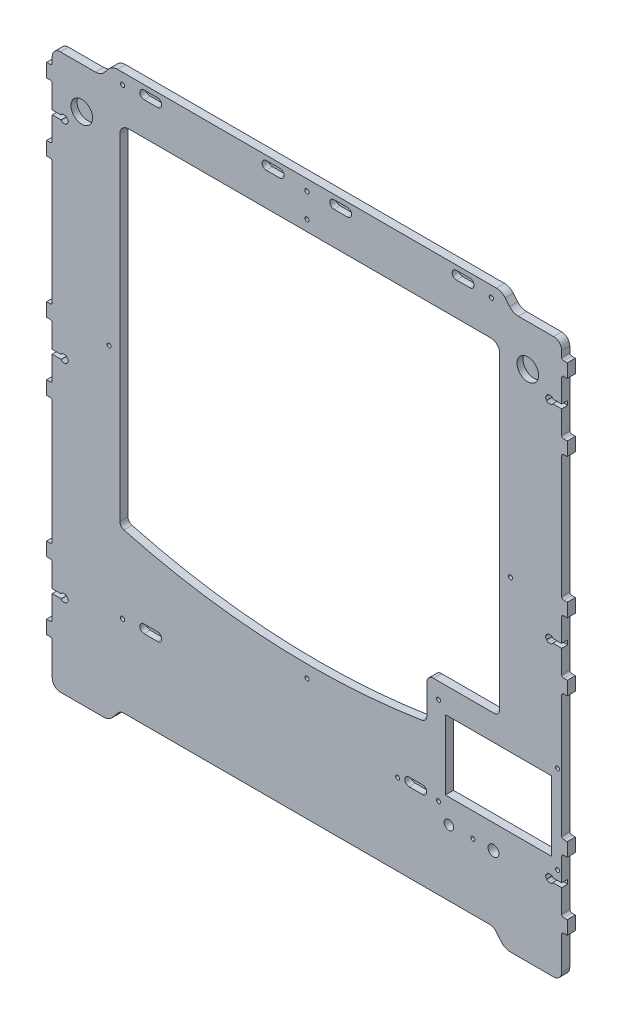
from build123d import *

# Parameters (mm, degrees)
CROQUIS1_R              = 1.6
SALIENTE_EXTRUIR1_DEPTH = 6
CROQUIS10_R             = 8
CROQUIS10_R_2           = 1.5
CROQUIS10_W             = 78.5
CROQUIS10_H             = 51.5
CORTAR_EXTRUIR4_DEPTH   = 4.5
CROQUIS12_R             = 1.5
CROQUIS12_R_2           = 3.5
CROQUIS12_R_3           = 4
CROQUIS12_W             = 78.5
CROQUIS12_H             = 51.5
CORTAR_EXTRUIR5_DEPTH   = 6
CROQUIS13_W             = 12.488895434
CROQUIS13_H             = 7.172211158
SALIENTE_EXTRUIR2_DEPTH = 6
CROQUIS14_R             = 1.5
CORTAR_EXTRUIR6_DEPTH   = 6
CROQUIS15_R             = 1.5
CORTAR_EXTRUIR7_DEPTH   = 6


with BuildPart() as part:
    # Croquis1 → Saliente-Extruir1 (new body)
    with BuildSketch(Plane.XY):
        with BuildLine():
            Line((-222.95465507, 205.76041627), (-222.95465507, 168.86041627))
            ThreePointArc((-222.95465507, 168.86041627), (-223.408639559, 167.764400759), (-224.50465507, 167.31041627))
            Line((-224.50465507, 167.31041627), (-227.10465507, 167.31041627))
            Line((-227.10465507, 167.31041627), (-227.10465507, 157.31041627))
            Line((-227.10465507, 157.31041627), (-224.504652909, 157.31041627))
            ThreePointArc((-224.504652909, 157.31041627), (-223.408638795, 156.856431017), (-222.95465507, 155.76041627))
            Line((-222.95465507, 155.76041627), (-222.95465507, 65.56041627))
            ThreePointArc((-222.95465507, 65.56041627), (-223.408638795, 64.464401523), (-224.504652909, 64.01041627))
            Line((-224.504652909, 64.01041627), (-227.10465507, 64.01041627))
            Line((-227.10465507, 64.01041627), (-227.10465507, 54.01041627))
            Line((-227.10465507, 54.01041627), (-224.50465507, 54.01041627))
            ThreePointArc((-224.50465507, 54.01041627), (-223.408639559, 53.556431781), (-222.95465507, 52.46041627))
            Line((-222.95465507, 52.46041627), (-222.95465507, 15.56041627))
            ThreePointArc((-222.95465507, 15.56041627), (-223.408639559, 14.464400759), (-224.50465507, 14.01041627))
            Line((-224.50465507, 14.01041627), (-227.10465507, 14.01041627))
            Line((-227.10465507, 14.01041627), (-227.10465507, 4.01041627))
            Line((-227.10465507, 4.01041627), (-224.50465507, 4.01041627))
            ThreePointArc((-224.50465507, 4.01041627), (-223.408639559, 3.556431781), (-222.95465507, 2.46041627))
            Line((-222.95465507, 2.46041627), (-222.95465507, -87.73958373))
            ThreePointArc((-222.95465507, -87.73958373), (-223.408638795, -88.835598477), (-224.504652909, -89.28958373))
            Line((-224.504652909, -89.28958373), (-227.10465507, -89.28958373))
            Line((-227.10465507, -89.28958373), (-227.10465507, -99.28958373))
            Line((-227.10465507, -99.28958373), (-224.50465507, -99.28958373))
            ThreePointArc((-224.50465507, -99.28958373), (-223.408639559, -99.743568219), (-222.95465507, -100.83958373))
            Line((-222.95465507, -100.83958373), (-222.95465507, -137.73958373))
            ThreePointArc((-222.95465507, -137.73958373), (-223.408639559, -138.835599241), (-224.50465507, -139.28958373))
            Line((-224.50465507, -139.28958373), (-227.10465507, -139.28958373))
            Line((-227.10465507, -139.28958373), (-227.10465507, -149.28958373))
            Line((-227.10465507, -149.28958373), (-224.50465507, -149.28958373))
            ThreePointArc((-224.50465507, -149.28958373), (-223.408639559, -149.743568219), (-222.95465507, -150.83958373))
            Line((-222.95465507, -150.83958373), (-222.95465507, -174.98958373))
            ThreePointArc((-222.95465507, -174.98958373), (-221.197295757, -179.232224417), (-216.95465507, -180.98958373))
            Line((-216.95465507, -180.98958373), (-184.95465507, -180.98958373))
            ThreePointArc((-184.95465507, -180.98958373), (-181.362399845, -180.19319992), (-178.443277303, -177.953278412))
            Line((-178.443277303, -177.953278412), (-174.251121407, -172.957261563))
            ThreePointArc((-174.251121407, -172.957261563), (-172.359383879, -171.505680303), (-170.031422678, -170.98958373))
            Line((-170.031422678, -170.98958373), (100.822112538, -170.98958373))
            ThreePointArc((100.822112538, -170.98958373), (103.15007374, -171.505680303), (105.041811268, -172.957261563))
            Line((105.041811268, -172.957261563), (109.233967164, -177.953278412))
            ThreePointArc((109.233967164, -177.953278412), (112.153089706, -180.19319992), (115.74534493, -180.98958373))
            Line((115.74534493, -180.98958373), (147.74534493, -180.98958373))
            ThreePointArc((147.74534493, -180.98958373), (151.987985617, -179.232224417), (153.74534493, -174.98958373))
            Line((153.74534493, -174.98958373), (153.74534493, -150.83958373))
            ThreePointArc((153.74534493, -150.83958373), (154.19932942, -149.743568219), (155.29534493, -149.28958373))
            Line((155.29534493, -149.28958373), (157.89534493, -149.28958373))
            Line((157.89534493, -149.28958373), (157.89534493, -139.28958373))
            Line((157.89534493, -139.28958373), (155.29534493, -139.28958373))
            ThreePointArc((155.29534493, -139.28958373), (154.19932942, -138.835599241), (153.74534493, -137.73958373))
            Line((153.74534493, -137.73958373), (153.74534493, -100.83958373))
            ThreePointArc((153.74534493, -100.83958373), (154.19932942, -99.743568219), (155.29534493, -99.28958373))
            Line((155.29534493, -99.28958373), (157.89534493, -99.28958373))
            Line((157.89534493, -99.28958373), (157.89534493, -89.28958373))
            Line((157.89534493, -89.28958373), (155.29534493, -89.28958373))
            ThreePointArc((155.29534493, -89.28958373), (154.19932942, -88.835599241), (153.74534493, -87.73958373))
            Line((153.74534493, -87.73958373), (153.74534493, 2.46041627))
            ThreePointArc((153.74534493, 2.46041627), (154.19932942, 3.556431781), (155.29534493, 4.01041627))
            Line((155.29534493, 4.01041627), (157.89534493, 4.01041627))
            Line((157.89534493, 4.01041627), (157.89534493, 14.01041627))
            Line((157.89534493, 14.01041627), (155.29534493, 14.01041627))
            ThreePointArc((155.29534493, 14.01041627), (154.19932942, 14.464400759), (153.74534493, 15.56041627))
            Line((153.74534493, 15.56041627), (153.74534493, 52.46041627))
            ThreePointArc((153.74534493, 52.46041627), (154.19932942, 53.556431781), (155.29534493, 54.01041627))
            Line((155.29534493, 54.01041627), (157.89534493, 54.01041627))
            Line((157.89534493, 54.01041627), (157.89534493, 64.01041627))
            Line((157.89534493, 64.01041627), (155.295342769, 64.01041627))
            ThreePointArc((155.295342769, 64.01041627), (154.199328655, 64.464401523), (153.74534493, 65.56041627))
            Line((153.74534493, 65.56041627), (153.74534493, 155.76041627))
            ThreePointArc((153.74534493, 155.76041627), (154.199328655, 156.856431017), (155.295342769, 157.31041627))
            Line((155.295342769, 157.31041627), (157.89534493, 157.31041627))
            Line((157.89534493, 157.31041627), (157.89534493, 167.31041627))
            Line((157.89534493, 167.31041627), (155.29534493, 167.31041627))
            ThreePointArc((155.29534493, 167.31041627), (154.19932942, 167.764400759), (153.74534493, 168.86041627))
            Line((153.74534493, 168.86041627), (153.74534493, 205.76041627))
            ThreePointArc((153.74534493, 205.76041627), (154.19932942, 206.856431781), (155.29534493, 207.31041627))
            Line((155.29534493, 207.31041627), (157.89534493, 207.31041627))
            Line((157.89534493, 207.31041627), (157.89534493, 217.31041627))
            Line((157.89534493, 217.31041627), (155.29534493, 217.31041627))
            ThreePointArc((155.29534493, 217.31041627), (154.19932942, 217.764400759), (153.74534493, 218.86041627))
            Line((153.74534493, 218.86041627), (153.74534493, 223.11041627))
            ThreePointArc((153.74534493, 223.11041627), (151.987985617, 227.353056957), (147.74534493, 229.11041627))
            Line((147.74534493, 229.11041627), (121.74534493, 229.11041627))
            ThreePointArc((121.74534493, 229.11041627), (118.153089706, 229.90680008), (115.233967164, 232.146721588))
            Line((115.233967164, 232.146721588), (112.02240616, 235.974110952))
            ThreePointArc((112.02240616, 235.974110952), (109.103283618, 238.21403246), (105.511028393, 239.01041627))
            Line((105.511028393, 239.01041627), (-174.720338532, 239.01041627))
            ThreePointArc((-174.720338532, 239.01041627), (-178.312593757, 238.21403246), (-181.231716299, 235.974110952))
            Line((-181.231716299, 235.974110952), (-184.443277303, 232.146721588))
            ThreePointArc((-184.443277303, 232.146721588), (-187.362399845, 229.90680008), (-190.95465507, 229.11041627))
            Line((-190.95465507, 229.11041627), (-216.95465507, 229.11041627))
            ThreePointArc((-216.95465507, 229.11041627), (-221.197295757, 227.353056957), (-222.95465507, 223.11041627))
            Line((-222.95465507, 223.11041627), (-222.95465507, 218.86041627))
            ThreePointArc((-222.95465507, 218.86041627), (-223.408639559, 217.764400759), (-224.50465507, 217.31041627))
            Line((-224.50465507, 217.31041627), (-227.10465507, 217.31041627))
            Line((-227.10465507, 217.31041627), (-227.10465507, 207.31041627))
            Line((-227.10465507, 207.31041627), (-224.50465507, 207.31041627))
            ThreePointArc((-224.50465507, 207.31041627), (-223.408639559, 206.856431781), (-222.95465507, 205.76041627))
        make_face()
        with Locations((101.74534493, 231.01041627)):
            Circle(CROQUIS1_R, mode=Mode.SUBTRACT)
        with Locations((-34.60465507, 231.01041627)):
            Circle(CROQUIS1_R, mode=Mode.SUBTRACT)
        with Locations((-170.95465507, 231.01041627)):
            Circle(CROQUIS1_R, mode=Mode.SUBTRACT)
        with Locations((-170.95465507, -110.98958373)):
            Circle(CROQUIS1_R, mode=Mode.SUBTRACT)
        with BuildLine():
            Line((101.39534493, 205.01041627), (-166.45465507, 205.01041627))
            ThreePointArc((-166.45465507, 205.01041627), (-171.050849147, 203.106610348), (-172.95465507, 198.51041627))
            Line((-172.95465507, 198.51041627), (-172.95465507, -49.660010713))
            ThreePointArc((-172.95465507, -49.660010713), (-172.129247219, -52.128238814), (-169.9851138, -53.603413365))
            ThreePointArc((-169.9851138, -53.603413365), (-60.467212832, -71.021336983), (50.278275073, -65.277505143))
            ThreePointArc((50.278275073, -65.277505143), (52.982386963, -63.764437894), (54.055237383, -60.8574488))
            Line((54.055237383, -60.8574488), (54.055237383, -39.067487222))
            ThreePointArc((54.055237383, -39.067487222), (55.49789864, -35.584594849), (58.980791013, -34.141933592))
            Line((58.980791013, -34.141933592), (103.876200862, -34.141933592))
            ThreePointArc((103.876200862, -34.141933592), (106.718164887, -32.964753549), (107.89534493, -30.122789524))
            Line((107.89534493, -30.122789524), (107.89534493, 198.51041627))
            ThreePointArc((107.89534493, 198.51041627), (105.991539008, 203.106610348), (101.39534493, 205.01041627))
        make_face(mode=Mode.SUBTRACT)
    extrude(amount=SALIENTE_EXTRUIR1_DEPTH)

    # Croquis10 → Cortar-Extruir4 (cut)
    with BuildSketch(Plane.XY.offset(6)):
        with Locations((128.74534493, 198.61041627)):
            Circle(CROQUIS10_R)
        with Locations((-201.10465507, 198.61041627)):
            Circle(CROQUIS10_R)
        with Locations((150.74534493, -110.98958373)):
            Circle(CROQUIS10_R_2)
        with Locations((150.74534493, -45.98958373)):
            Circle(CROQUIS10_R_2)
        with Locations((62.74534493, -45.98958373)):
            Circle(CROQUIS10_R_2)
        with Locations((62.74534493, -110.98958373)):
            Circle(CROQUIS10_R_2)
        with BuildLine():
            Line((-216.454429827, 188.86041627), (-222.95465507, 188.86041627))
            Line((-222.95465507, 188.86041627), (-222.95465507, 185.76041627))
            Line((-222.95465507, 185.76041627), (-216.454429827, 185.76041627))
            ThreePointArc((-216.454429827, 185.76041627), (-215.908828016, 184.89695016), (-214.94446294, 184.56041627))
            Line((-214.94446294, 184.56041627), (-213.39446294, 184.56041627))
            ThreePointArc((-213.39446294, 184.56041627), (-212.424527577, 184.901397911), (-211.881340797, 185.77431899))
            Line((-211.881340797, 185.77431899), (-211.881340797, 185.943563923))
            ThreePointArc((-211.881340797, 185.943563923), (-211.062022675, 187.31041627), (-211.881340797, 188.677268617))
            Line((-211.881340797, 188.677268617), (-211.881340797, 188.84651355))
            ThreePointArc((-211.881340797, 188.84651355), (-212.424527577, 189.719434629), (-213.39446294, 190.06041627))
            Line((-213.39446294, 190.06041627), (-214.94446294, 190.06041627))
            ThreePointArc((-214.94446294, 190.06041627), (-215.908828016, 189.72388238), (-216.454429827, 188.86041627))
        make_face()
        with BuildLine():
            Line((-216.454429827, 35.56041627), (-222.95465507, 35.56041627))
            Line((-222.95465507, 35.56041627), (-222.95465507, 32.46041627))
            Line((-222.95465507, 32.46041627), (-216.454429827, 32.46041627))
            ThreePointArc((-216.454429827, 32.46041627), (-215.908828016, 31.59695016), (-214.94446294, 31.26041627))
            Line((-214.94446294, 31.26041627), (-213.39446294, 31.26041627))
            ThreePointArc((-213.39446294, 31.26041627), (-212.424527577, 31.601397911), (-211.881340797, 32.47431899))
            Line((-211.881340797, 32.47431899), (-211.881340797, 32.643563923))
            ThreePointArc((-211.881340797, 32.643563923), (-211.062022675, 34.01041627), (-211.881340797, 35.377268617))
            Line((-211.881340797, 35.377268617), (-211.881340797, 35.54651355))
            ThreePointArc((-211.881340797, 35.54651355), (-212.424527577, 36.419434629), (-213.39446294, 36.76041627))
            Line((-213.39446294, 36.76041627), (-214.94446294, 36.76041627))
            ThreePointArc((-214.94446294, 36.76041627), (-215.908828016, 36.42388238), (-216.454429827, 35.56041627))
        make_face()
        with BuildLine():
            Line((-216.454429827, -117.73958373), (-222.95465507, -117.73958373))
            Line((-222.95465507, -117.73958373), (-222.95465507, -120.83958373))
            Line((-222.95465507, -120.83958373), (-216.454429827, -120.83958373))
            ThreePointArc((-216.454429827, -120.83958373), (-215.908828016, -121.70304984), (-214.94446294, -122.03958373))
            Line((-214.94446294, -122.03958373), (-213.39446294, -122.03958373))
            ThreePointArc((-213.39446294, -122.03958373), (-212.424527577, -121.698602089), (-211.881340797, -120.82568101))
            Line((-211.881340797, -120.82568101), (-211.881340797, -120.656436077))
            ThreePointArc((-211.881340797, -120.656436077), (-211.062022675, -119.28958373), (-211.881340797, -117.922731383))
            Line((-211.881340797, -117.922731383), (-211.881340797, -117.75348645))
            ThreePointArc((-211.881340797, -117.75348645), (-212.424527577, -116.880565371), (-213.39446294, -116.53958373))
            Line((-213.39446294, -116.53958373), (-214.94446294, -116.53958373))
            ThreePointArc((-214.94446294, -116.53958373), (-215.908828016, -116.87611762), (-216.454429827, -117.73958373))
        make_face()
        with BuildLine():
            Line((147.245119688, -120.83958373), (153.74534493, -120.83958373))
            Line((153.74534493, -120.83958373), (153.74534493, -117.73958373))
            Line((153.74534493, -117.73958373), (147.245119688, -117.73958373))
            ThreePointArc((147.245119688, -117.73958373), (146.699517877, -116.87611762), (145.735152801, -116.53958373))
            Line((145.735152801, -116.53958373), (144.185152801, -116.53958373))
            ThreePointArc((144.185152801, -116.53958373), (143.215217438, -116.880565371), (142.672030658, -117.75348645))
            Line((142.672030658, -117.75348645), (142.672030658, -117.922731383))
            ThreePointArc((142.672030658, -117.922731383), (141.852712535, -119.28958373), (142.672030658, -120.656436077))
            Line((142.672030658, -120.656436077), (142.672030658, -120.82568101))
            ThreePointArc((142.672030658, -120.82568101), (143.215217438, -121.698602089), (144.185152801, -122.03958373))
            Line((144.185152801, -122.03958373), (145.735152801, -122.03958373))
            ThreePointArc((145.735152801, -122.03958373), (146.699517877, -121.70304984), (147.245119688, -120.83958373))
        make_face()
        with BuildLine():
            Line((147.245119688, 32.46041627), (153.74534493, 32.46041627))
            Line((153.74534493, 32.46041627), (153.74534493, 35.56041627))
            Line((153.74534493, 35.56041627), (147.245119688, 35.56041627))
            ThreePointArc((147.245119688, 35.56041627), (146.699517877, 36.42388238), (145.735152801, 36.76041627))
            Line((145.735152801, 36.76041627), (144.185152801, 36.76041627))
            ThreePointArc((144.185152801, 36.76041627), (143.215217438, 36.419434629), (142.672030658, 35.54651355))
            Line((142.672030658, 35.54651355), (142.672030658, 35.377268617))
            ThreePointArc((142.672030658, 35.377268617), (141.852712535, 34.01041627), (142.672030658, 32.643563923))
            Line((142.672030658, 32.643563923), (142.672030658, 32.47431899))
            ThreePointArc((142.672030658, 32.47431899), (143.215217438, 31.601397911), (144.185152801, 31.26041627))
            Line((144.185152801, 31.26041627), (145.735152801, 31.26041627))
            ThreePointArc((145.735152801, 31.26041627), (146.699517877, 31.59695016), (147.245119688, 32.46041627))
        make_face()
        with BuildLine():
            Line((147.245119688, 185.76041627), (153.74534493, 185.76041627))
            Line((153.74534493, 185.76041627), (153.74534493, 188.86041627))
            Line((153.74534493, 188.86041627), (147.245119688, 188.86041627))
            ThreePointArc((147.245119688, 188.86041627), (146.699517877, 189.72388238), (145.735152801, 190.06041627))
            Line((145.735152801, 190.06041627), (144.185152801, 190.06041627))
            ThreePointArc((144.185152801, 190.06041627), (143.215217438, 189.719434629), (142.672030658, 188.84651355))
            Line((142.672030658, 188.84651355), (142.672030658, 188.677268617))
            ThreePointArc((142.672030658, 188.677268617), (141.852712535, 187.31041627), (142.672030658, 185.943563923))
            Line((142.672030658, 185.943563923), (142.672030658, 185.77431899))
            ThreePointArc((142.672030658, 185.77431899), (143.215217438, 184.901397911), (144.185152801, 184.56041627))
            Line((144.185152801, 184.56041627), (145.735152801, 184.56041627))
            ThreePointArc((145.735152801, 184.56041627), (146.699517877, 184.89695016), (147.245119688, 185.76041627))
        make_face()
        with BuildLine():
            Line((-64.60465507, 235.61041627), (-54.60465507, 235.61041627))
            ThreePointArc((-54.60465507, 235.61041627), (-51.50465507, 232.51041627), (-54.60465507, 229.41041627))
            Line((-54.60465507, 229.41041627), (-64.60465507, 229.41041627))
            ThreePointArc((-64.60465507, 229.41041627), (-67.70465507, 232.51041627), (-64.60465507, 235.61041627))
        make_face()
        with BuildLine():
            Line((-155.10465507, 235.61041627), (-145.10465507, 235.61041627))
            ThreePointArc((-145.10465507, 235.61041627), (-142.00465507, 232.51041627), (-145.10465507, 229.41041627))
            Line((-145.10465507, 229.41041627), (-155.10465507, 229.41041627))
            ThreePointArc((-155.10465507, 229.41041627), (-158.20465507, 232.51041627), (-155.10465507, 235.61041627))
        make_face()
        with BuildLine():
            Line((-4.60465507, 229.41041627), (-14.60465507, 229.41041627))
            ThreePointArc((-14.60465507, 229.41041627), (-17.70465507, 232.51041627), (-14.60465507, 235.61041627))
            Line((-14.60465507, 235.61041627), (-4.60465507, 235.61041627))
            ThreePointArc((-4.60465507, 235.61041627), (-1.50465507, 232.51041627), (-4.60465507, 229.41041627))
        make_face()
        with BuildLine():
            Line((85.89534493, 235.61041627), (75.89534493, 235.61041627))
            ThreePointArc((75.89534493, 235.61041627), (72.79534493, 232.51041627), (75.89534493, 229.41041627))
            Line((75.89534493, 229.41041627), (85.89534493, 229.41041627))
            ThreePointArc((85.89534493, 229.41041627), (88.99534493, 232.51041627), (85.89534493, 235.61041627))
        make_face()
        with BuildLine():
            Line((-155.10465507, -106.38958373), (-145.10465507, -106.38958373))
            ThreePointArc((-145.10465507, -106.38958373), (-142.00465507, -109.48958373), (-145.10465507, -112.58958373))
            Line((-145.10465507, -112.58958373), (-155.10465507, -112.58958373))
            ThreePointArc((-155.10465507, -112.58958373), (-158.20465507, -109.48958373), (-155.10465507, -106.38958373))
        make_face()
        with Locations((106.99534493, -78.73958373)):
            Rectangle(CROQUIS10_W, CROQUIS10_H)
        with BuildLine():
            Line((50.89534493, -106.38958373), (40.89534493, -106.38958373))
            ThreePointArc((40.89534493, -106.38958373), (37.79534493, -109.48958373), (40.89534493, -112.58958373))
            Line((40.89534493, -112.58958373), (50.89534493, -112.58958373))
            ThreePointArc((50.89534493, -112.58958373), (53.99534493, -109.48958373), (50.89534493, -106.38958373))
        make_face()
    extrude(amount=-CORTAR_EXTRUIR4_DEPTH, mode=Mode.SUBTRACT)

    # Croquis12 → Cortar-Extruir5 (cut)
    with BuildSketch(Plane.XY.offset(6)):
        with Locations((150.74534493, -110.98958373)):
            Circle(CROQUIS12_R)
        with Locations((150.74534493, -45.98958373)):
            Circle(CROQUIS12_R)
        with Locations((62.74534493, -45.98958373)):
            Circle(CROQUIS12_R)
        with Locations((62.74534493, -110.98958373)):
            Circle(CROQUIS12_R)
        with Locations((70.34534493, -122.33958373)):
            Circle(CROQUIS12_R_2)
        with Locations((88.09534493, -122.33958373)):
            Circle(CROQUIS12_R)
        with Locations((103.34534493, -122.33958373)):
            Circle(CROQUIS12_R_3)
        with Locations((106.99534493, -78.73958373)):
            Rectangle(CROQUIS12_W, CROQUIS12_H)
    extrude(amount=-CORTAR_EXTRUIR5_DEPTH, mode=Mode.SUBTRACT)

    # Croquis13 → Saliente-Extruir2 (add)
    with BuildSketch(Plane.XY.offset(6)):
        with Locations((102.714741828, -111.153279876)):
            Rectangle(CROQUIS13_W, CROQUIS13_H)
    extrude(amount=-SALIENTE_EXTRUIR2_DEPTH)

    # Croquis14 → Cortar-Extruir6 (cut)
    with BuildSketch(Plane.XY.offset(6)):
        with Locations((62.74534493, -110.98958373)):
            Circle(CROQUIS14_R)
        with Locations((32.38631374, -110.98958373)):
            Circle(CROQUIS14_R)
    extrude(amount=-CORTAR_EXTRUIR6_DEPTH, mode=Mode.SUBTRACT)

    # Croquis15 → Cortar-Extruir7 (cut)
    with BuildSketch(Plane(origin=(0, 0, 0), x_dir=(-1, 0, 0), z_dir=(0, 0, -1))):
        with Locations((34.60465507, 213.01041627)):
            Circle(CROQUIS15_R)
        with Locations((-115.89534493, 59.01041627)):
            Circle(CROQUIS15_R)
        with Locations((180.95465507, 59.01041627)):
            Circle(CROQUIS15_R)
        with Locations((34.60465507, -80.98958373)):
            Circle(CROQUIS15_R)
    extrude(amount=-CORTAR_EXTRUIR7_DEPTH, mode=Mode.SUBTRACT)


solid = part.part
